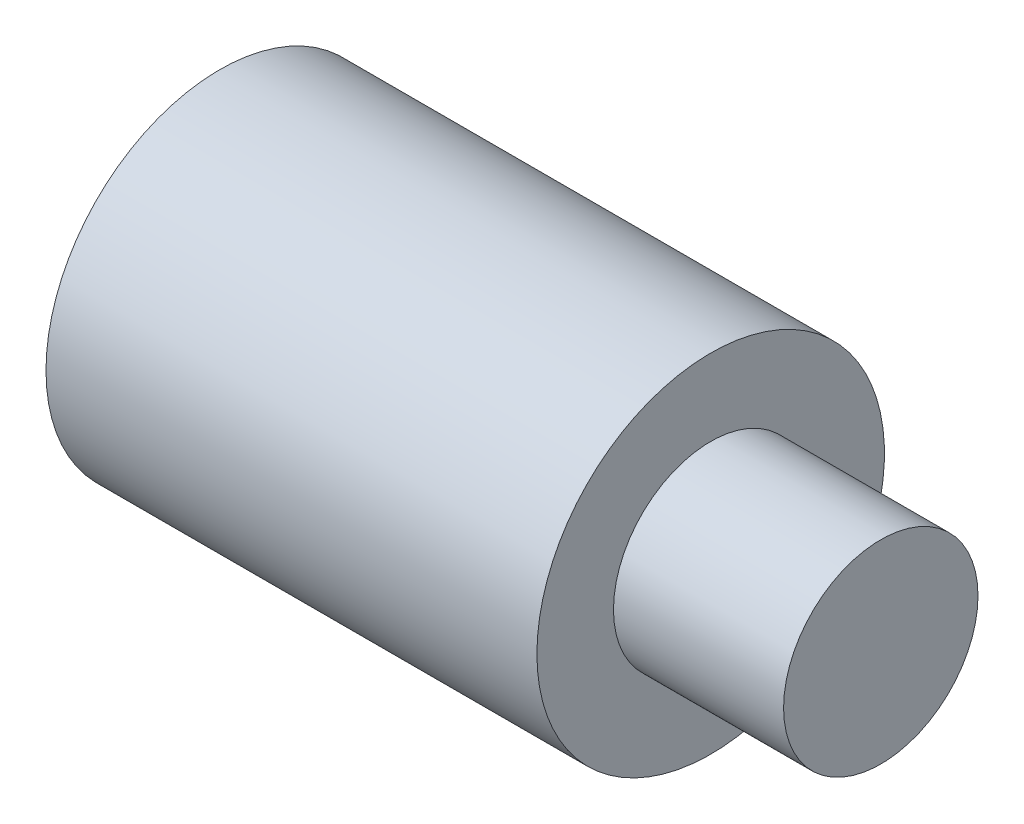
from build123d import *


with BuildPart() as part:
    # Sketch1 → Revolve1 (revolve)
    with BuildSketch(Plane.XY, mode=Mode.PRIVATE) as revolve1_sk:
        Polygon((0, 1.5), (0, 0), (8.6, 0), (8.6, -2.075), (13.6, -2.075), (13.6, -0.075), (10.1, -0.075), (10.1, 1.5), align=None)
    revolve(revolve1_sk.sketch.rotate(Axis((8.6, -2.075, 0), (1, 0, 0)), 90), axis=Axis((8.6, -2.075, 0), (1, 0, 0)))


solid = part.part
